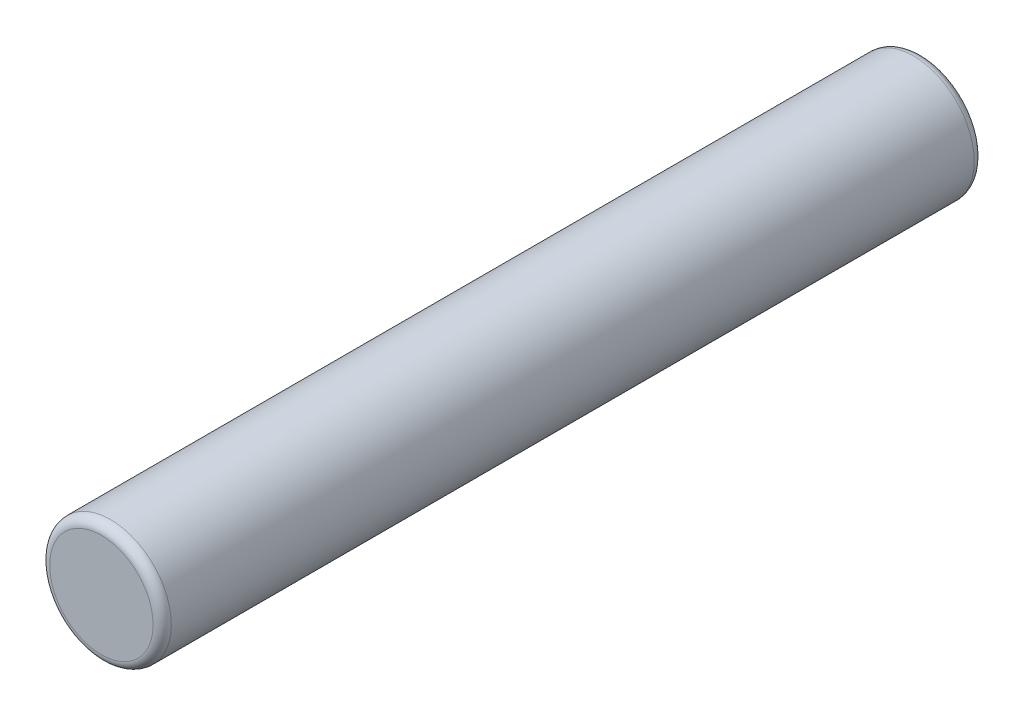
from build123d import *

# Parameters (mm, degrees)
SKETCH1_R           = 20
BOSS_EXTRUDE1_DEPTH = 135
FILLET1_R           = 3


with BuildPart() as part:
    # Sketch1 → Boss-Extrude1 (new, symmetric)
    with BuildSketch(Plane.XY):
        Circle(SKETCH1_R)
    extrude(amount=BOSS_EXTRUDE1_DEPTH, both=True)

    # Fillet1
    fillet1_edges = [part.edges().sort_by_distance(p)[0] for p in [
        (-20, 0, -135),
        (-20, 0, 135),
    ]]
    fillet(fillet1_edges, radius=FILLET1_R)


solid = part.part
